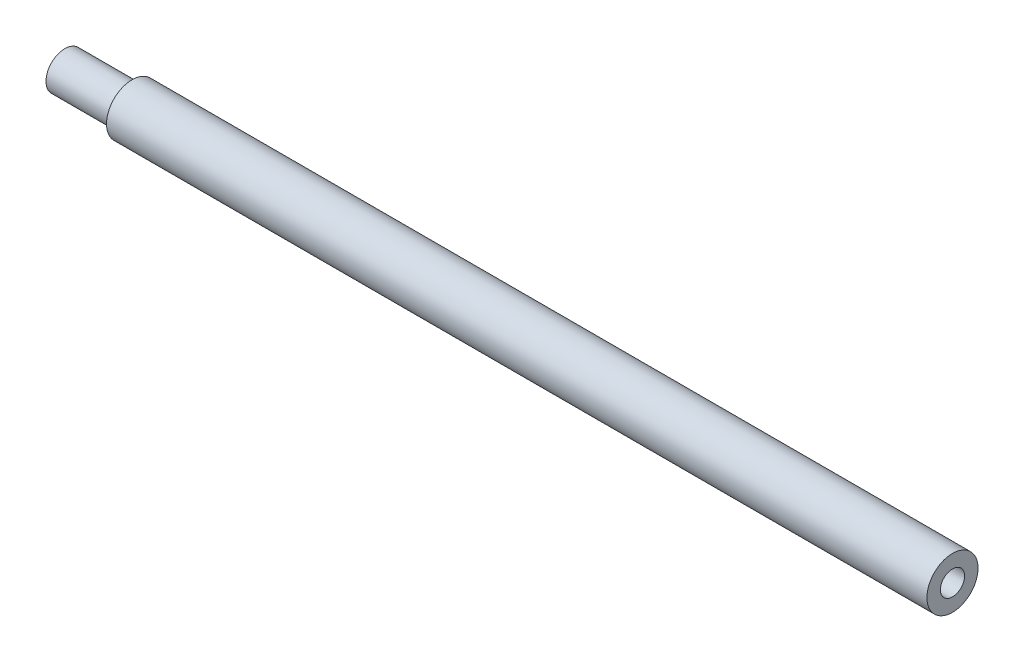
from build123d import *


with BuildPart() as part:
    # Sketch1 → Revolve1 (revolve)
    with BuildSketch(Plane.XY, mode=Mode.PRIVATE) as revolve1_sk:
        Polygon((0, -0.45), (33, -0.45), (33, -0.95), (2.5, -0.95), (2.5, -0.7), (0, -0.7), align=None)
    revolve(revolve1_sk.sketch.rotate(Axis((-88.99, 0, 0), (1, 0, 0)), 270), axis=Axis((-88.99, 0, 0), (1, 0, 0)))


solid = part.part
